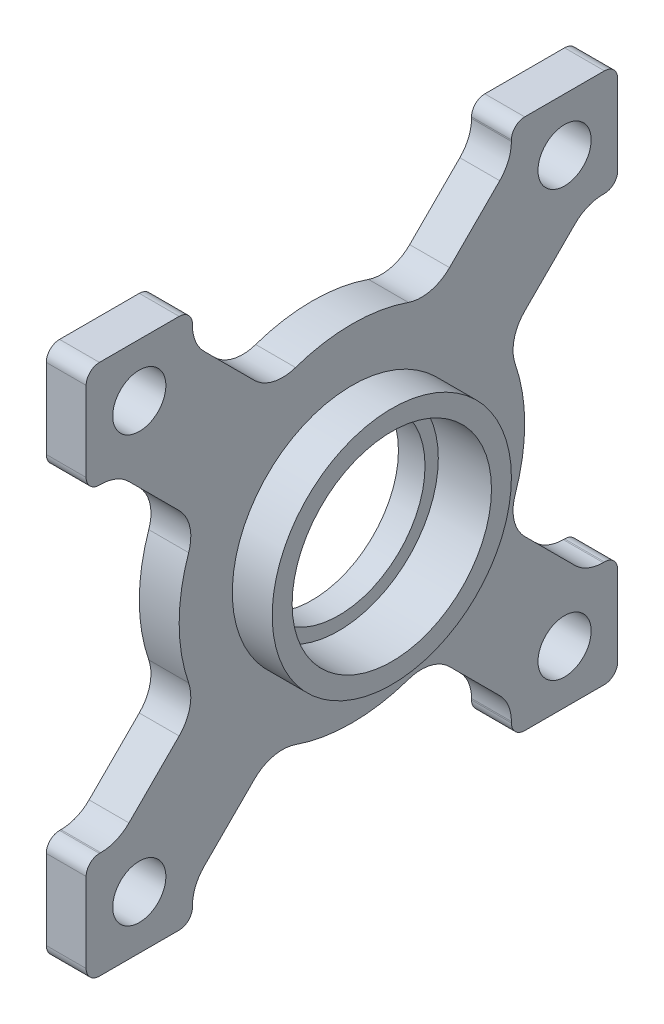
from build123d import *

# Parameters (mm, degrees)
SKETCH_1_R          = 2
EXTRUDE_1_DEPTH     = 3
SKETCH_2_R          = 9
EXTRUDE_2_DEPTH     = 3
SKETCH_3_R          = 7.5
CUT_EXTRUDE_1_DEPTH = 4
SKETCH_4_R          = 6.5
CUT_EXTRUDE_2_DEPTH = 57.709787515


with BuildPart() as part:
    # 草图1 → 凸台-拉伸1 (new body)
    with BuildSketch(Plane(origin=(0, 0, 0), x_dir=(0, 0, -1), z_dir=(1, 0, 0))):
        with BuildLine():
            Line((1, 0), (7, 0))
            ThreePointArc((7, 0), (7.707106781, -0.292893219), (8, -1))
            Line((8, -1), (8, -1.100505063))
            ThreePointArc((8, -1.100505063), (8.228361402, -2.24855536), (8.878679656, -3.221825407))
            Line((8.878679656, -3.221825407), (12.65493215, -6.998077901))
            ThreePointArc((12.65493215, -6.998077901), (14.102815672, -7.800194378), (15.755705151, -7.712365515))
            ThreePointArc((15.755705151, -7.712365515), (20, -7), (24.244294849, -7.712365515))
            ThreePointArc((24.244294849, -7.712365515), (25.897184328, -7.800194378), (27.34506785, -6.998077901))
            Line((27.34506785, -6.998077901), (31.121320344, -3.221825407))
            ThreePointArc((31.121320344, -3.221825407), (31.771638598, -2.24855536), (32, -1.100505063))
            Line((32, -1.100505063), (32, -1))
            ThreePointArc((32, -1), (32.292893219, -0.292893219), (33, 0))
            Line((33, 0), (39, 0))
            ThreePointArc((39, 0), (39.707106781, -0.292893219), (40, -1))
            Line((40, -1), (40, -7))
            ThreePointArc((40, -7), (39.707106781, -7.707106781), (39, -8))
            Line((39, -8), (38.899494937, -8))
            ThreePointArc((38.899494937, -8), (37.75144464, -8.228361402), (36.778174593, -8.878679656))
            Line((36.778174593, -8.878679656), (33.001922099, -12.65493215))
            ThreePointArc((33.001922099, -12.65493215), (32.199805622, -14.102815672), (32.287634485, -15.755705151))
            ThreePointArc((32.287634485, -15.755705151), (33, -20), (32.287634485, -24.244294849))
            ThreePointArc((32.287634485, -24.244294849), (32.199805622, -25.897184328), (33.001922099, -27.34506785))
            Line((33.001922099, -27.34506785), (36.778174593, -31.121320344))
            ThreePointArc((36.778174593, -31.121320344), (37.75144464, -31.771638598), (38.899494937, -32))
            Line((38.899494937, -32), (39, -32))
            ThreePointArc((39, -32), (39.707106781, -32.292893219), (40, -33))
            Line((40, -33), (40, -39))
            ThreePointArc((40, -39), (39.707106781, -39.707106781), (39, -40))
            Line((39, -40), (33, -40))
            ThreePointArc((33, -40), (32.292893219, -39.707106781), (32, -39))
            Line((32, -39), (32, -38.899494937))
            ThreePointArc((32, -38.899494937), (31.771638598, -37.75144464), (31.121320344, -36.778174593))
            Line((31.121320344, -36.778174593), (27.34506785, -33.001922099))
            ThreePointArc((27.34506785, -33.001922099), (25.897184328, -32.199805622), (24.244294849, -32.287634485))
            ThreePointArc((24.244294849, -32.287634485), (20, -33), (15.755705151, -32.287634485))
            ThreePointArc((15.755705151, -32.287634485), (14.102815672, -32.199805622), (12.65493215, -33.001922099))
            Line((12.65493215, -33.001922099), (8.878679656, -36.778174593))
            ThreePointArc((8.878679656, -36.778174593), (8.228361402, -37.75144464), (8, -38.899494937))
            Line((8, -38.899494937), (8, -39))
            ThreePointArc((8, -39), (7.707106781, -39.707106781), (7, -40))
            Line((7, -40), (1, -40))
            ThreePointArc((1, -40), (0.292893219, -39.707106781), (0, -39))
            Line((0, -39), (0, -33))
            ThreePointArc((0, -33), (0.292893219, -32.292893219), (1, -32))
            Line((1, -32), (1.100505063, -32))
            ThreePointArc((1.100505063, -32), (2.24855536, -31.771638598), (3.221825407, -31.121320344))
            Line((3.221825407, -31.121320344), (6.998077901, -27.34506785))
            ThreePointArc((6.998077901, -27.34506785), (7.800194378, -25.897184328), (7.712365515, -24.244294849))
            ThreePointArc((7.712365515, -24.244294849), (7, -20), (7.712365515, -15.755705151))
            ThreePointArc((7.712365515, -15.755705151), (7.800194378, -14.102815672), (6.998077901, -12.65493215))
            Line((6.998077901, -12.65493215), (3.221825407, -8.878679656))
            ThreePointArc((3.221825407, -8.878679656), (2.24855536, -8.228361402), (1.100505063, -8))
            Line((1.100505063, -8), (1, -8))
            ThreePointArc((1, -8), (0.292893219, -7.707106781), (0, -7))
            Line((0, -7), (0, -1))
            ThreePointArc((0, -1), (0.292893219, -0.292893219), (1, 0))
        make_face()
        with Locations((4, -4)):
            Circle(SKETCH_1_R, mode=Mode.SUBTRACT)
        with Locations((36, -4)):
            Circle(SKETCH_1_R, mode=Mode.SUBTRACT)
        with Locations((4, -36)):
            Circle(SKETCH_1_R, mode=Mode.SUBTRACT)
        with Locations((36, -36)):
            Circle(SKETCH_1_R, mode=Mode.SUBTRACT)
    extrude(amount=EXTRUDE_1_DEPTH)

    # 草图2 → 凸台-拉伸2 (add)
    with BuildSketch(Plane(origin=(3, 0, 0), x_dir=(0, 0, -1), z_dir=(1, 0, 0))):
        with Locations((20, -20)):
            Circle(SKETCH_2_R)
    extrude(amount=EXTRUDE_2_DEPTH)

    # 草图3 → 切除-拉伸1 (cut)
    with BuildSketch(Plane(origin=(6, 0, 0), x_dir=(0, 0, -1), z_dir=(1, 0, 0))):
        with Locations((20, -20)):
            Circle(SKETCH_3_R)
    extrude(amount=-CUT_EXTRUDE_1_DEPTH, mode=Mode.SUBTRACT)

    # 草图4 → 切除-拉伸2 (cut, through all)
    with BuildSketch(Plane(origin=(2, 0, 0), x_dir=(0, 0, -1), z_dir=(1, 0, 0))):
        with Locations((20, -20)):
            Circle(SKETCH_4_R)
    extrude(amount=-CUT_EXTRUDE_2_DEPTH, mode=Mode.SUBTRACT)


solid = part.part
